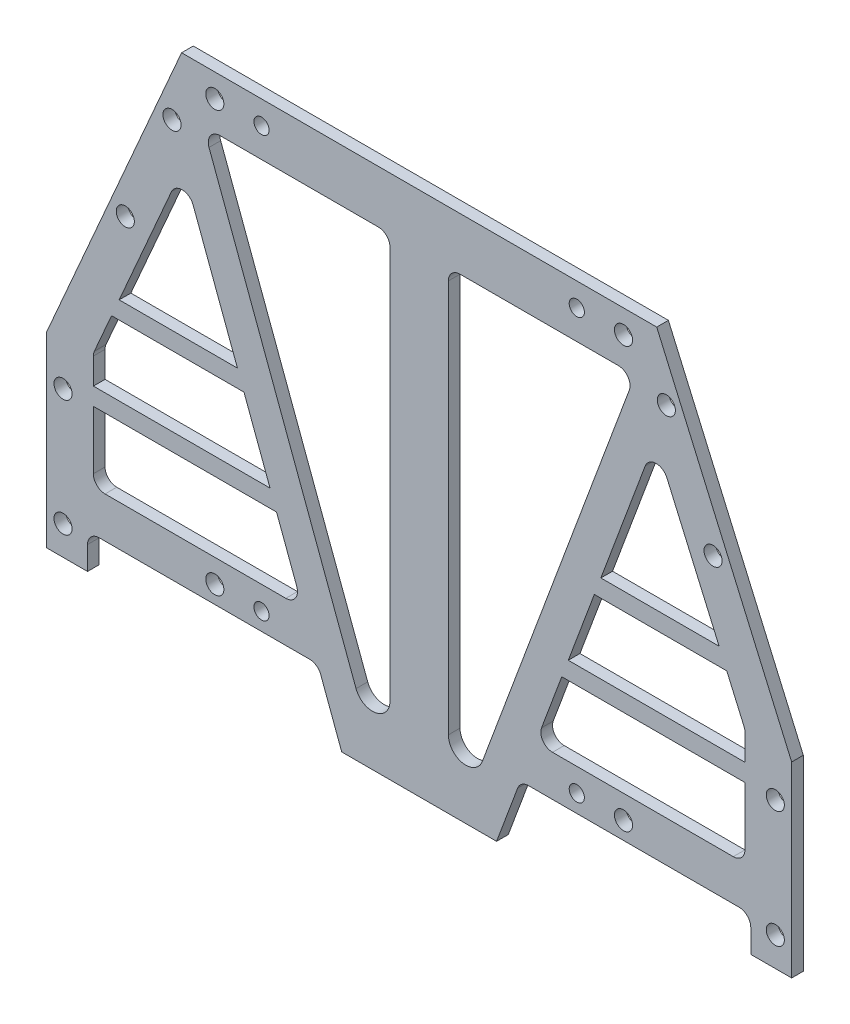
from build123d import *

# Parameters (mm, degrees)
SKETCH_1_R          = 40.9
SKETCH_1_R_2        = 1.525
EXTRUDE_1_DEPTH     = 2
EXTRUDE_2_DEPTH     = 2
SKETCH_4_R          = 1.55
CUT_EXTRUDE_2_DEPTH = 10
SKETCH_5_OUTSIDE_W  = 183.288
SKETCH_5_OUTSIDE_H  = 259.388
CUT_EXTRUDE_3_DEPTH = 10
SKETCH_7_R          = 1.3
SKETCH_7_R_2        = 1.55
CUT_EXTRUDE_4_DEPTH = 10
CUT_EXTRUDE_5_DEPTH = 10
SKETCH_9_W          = 25.793449444
SKETCH_9_H          = 3
SKETCH_9_W_2        = 31.374844792
EXTRUDE_4_DEPTH     = 2
SKETCH_12_W         = 20
SKETCH_12_H         = 5
CUT_EXTRUDE_7_DEPTH = 10


with BuildPart() as part:
    # 草图1 → 凸台-拉伸1 (new body)
    with BuildSketch(Plane.XY):
        with BuildLine():
            Line((-48, 105.1), (48, 105.1))
            Line((48, 105.1), (66, 105.1))
            Line((66, 105.1), (66, 52.6))
            Line((66, 52.6), (45.955327857, -13.860297311))
            ThreePointArc((45.955327857, -13.860297311), (0, -48), (-45.955327857, -13.860297311))
            Line((-45.955327857, -13.860297311), (-66, 52.6))
            Line((-66, 52.6), (-66, 105.1))
            Line((-66, 105.1), (-48, 105.1))
        make_face()
        Circle(SKETCH_1_R, mode=Mode.SUBTRACT)
        with Locations((12.835117837, 41.981778787)):
            Circle(SKETCH_1_R_2, mode=Mode.SUBTRACT)
        with Locations((-17.153096541, 40.410163067)):
            Circle(SKETCH_1_R_2, mode=Mode.SUBTRACT)
        with Locations((-31.749094475, 31.749094475)):
            Circle(SKETCH_1_R_2, mode=Mode.SUBTRACT)
        with Locations((31.749094475, 31.749094475)):
            Circle(SKETCH_1_R_2, mode=Mode.SUBTRACT)
        with Locations((31.749094475, -31.749094475)):
            Circle(SKETCH_1_R_2, mode=Mode.SUBTRACT)
        with Locations((-31.749094475, -31.749094475)):
            Circle(SKETCH_1_R_2, mode=Mode.SUBTRACT)
        with Locations((-9.5, 52.6)):
            Circle(SKETCH_1_R_2, mode=Mode.SUBTRACT)
        with Locations((9.5, 52.6)):
            Circle(SKETCH_1_R_2, mode=Mode.SUBTRACT)
    extrude(amount=EXTRUDE_1_DEPTH)

    # 草图3 → 凸台-拉伸2 (add)
    with BuildSketch(Plane.XY.offset(2)):
        Polygon((-66, 105.1), (-42, 160.1), (-22, 160.1), (22, 160.1), (42, 160.1), (66, 105.1), (22, 105.1), (-22, 105.1), align=None)
    extrude(amount=-EXTRUDE_2_DEPTH)

    # 草图4 → 切除-拉伸2 (cut)
    with BuildSketch(Plane.XY.offset(2)):
        with Locations((-61, 100.1)):
            Circle(SKETCH_4_R)
        with Locations((-61, 80.1)):
            Circle(SKETCH_4_R)
        with Locations((-42.333287047, 149.334828392)):
            Circle(SKETCH_4_R)
        with Locations((-50.332176167, 131.004040825)):
            Circle(SKETCH_4_R)
        with Locations((61, 80.1)):
            Circle(SKETCH_4_R)
        with Locations((61, 100.1)):
            Circle(SKETCH_4_R)
        with Locations((50.332176167, 131.004040825)):
            Circle(SKETCH_4_R)
        with Locations((42.333287047, 149.334828392)):
            Circle(SKETCH_4_R)
    extrude(amount=-CUT_EXTRUDE_2_DEPTH, mode=Mode.SUBTRACT)

    # 草图5 outside → 切除-拉伸3 (cut)
    with BuildSketch(Plane.XY.offset(2)):
        with Locations((0, 56.05)):
            Rectangle(SKETCH_5_OUTSIDE_W, SKETCH_5_OUTSIDE_H)
        Polygon((-40.690727285, 160.1), (-63.8, 107.141250029), (-63.8, 70.1), (63.8, 70.1), (63.8, 107.141250029), (40.690727285, 160.1), align=None, mode=Mode.SUBTRACT)
    extrude(amount=-CUT_EXTRUDE_3_DEPTH, mode=Mode.SUBTRACT)

    # 草图7 → 切除-拉伸4 (cut)
    with BuildSketch(Plane(origin=(0, 0, 0), x_dir=(-1, 0, 0), z_dir=(0, 0, -1))):
        with Locations((-27, 156.1)):
            Circle(SKETCH_7_R)
        with Locations((27, 156.1)):
            Circle(SKETCH_7_R)
        with Locations((-27, 84.1)):
            Circle(SKETCH_7_R)
        with Locations((27, 84.1)):
            Circle(SKETCH_7_R)
        with Locations((-35, 156.1)):
            Circle(SKETCH_7_R_2)
        with Locations((35, 156.1)):
            Circle(SKETCH_7_R_2)
        with Locations((-35, 84.1)):
            Circle(SKETCH_7_R_2)
        with Locations((35, 84.1)):
            Circle(SKETCH_7_R_2)
    extrude(amount=-CUT_EXTRUDE_4_DEPTH, mode=Mode.SUBTRACT)

    # 草图8 → 切除-拉伸5 (cut)
    with BuildSketch(Plane(origin=(0, 0, 0), x_dir=(-1, 0, 0), z_dir=(0, 0, -1))):
        with BuildLine():
            Line((-34.121847489, 151.1), (-7, 151.1))
            ThreePointArc((-7, 151.1), (-5.585786438, 150.514213562), (-5, 149.1))
            Line((-5, 149.1), (-5, 81.76505231))
            ThreePointArc((-5, 81.76505231), (-7.468491138, 78.812511315), (-10.811665553, 80.718851174))
            Line((-10.811665553, 80.718851174), (-35.996291191, 148.402532576))
            ThreePointArc((-35.996291191, 148.402532576), (-35.764244342, 150.241285493), (-34.121847489, 151.1))
        make_face()
        with BuildLine():
            Line((-38.719517417, 138.516098438), (-20.963747737, 90.797467424))
            ThreePointArc((-20.963747737, 90.797467424), (-21.195794586, 88.958714507), (-22.83819144, 88.1))
            Line((-22.83819144, 88.1), (-53.8, 88.1))
            ThreePointArc((-53.8, 88.1), (-55.214213562, 88.685786438), (-55.8, 90.1))
            Line((-55.8, 90.1), (-55.8, 107.554791913))
            ThreePointArc((-55.8, 107.554791913), (-55.757825007, 107.963351875), (-55.633078757, 108.354680825))
            Line((-55.633078757, 108.354680825), (-42.427039876, 138.618519926))
            ThreePointArc((-42.427039876, 138.618519926), (-40.538731553, 139.817868293), (-38.719517417, 138.516098438))
        make_face()
        with BuildLine():
            Line((-56.8, 79.1), (-56.8, 67.1))
            ThreePointArc((-56.8, 67.1), (-56.214213562, 65.685786438), (-54.8, 65.1))
            Line((-54.8, 65.1), (-14.280051905, 65.1))
            ThreePointArc((-14.280051905, 65.1), (-12.637655051, 65.958714507), (-12.405608203, 67.797467424))
            Line((-12.405608203, 67.797467424), (-16.870724482, 79.797467424))
            ThreePointArc((-16.870724482, 79.797467424), (-17.603882691, 80.742396853), (-18.745168184, 81.1))
            Line((-18.745168184, 81.1), (-54.8, 81.1))
            ThreePointArc((-54.8, 81.1), (-56.214213562, 80.514213562), (-56.8, 79.1))
        make_face()
        with BuildLine():
            Line((18.745168184, 81.1), (54.8, 81.1))
            ThreePointArc((54.8, 81.1), (56.214213562, 80.514213562), (56.8, 79.1))
            Line((56.8, 79.1), (56.8, 67.1))
            ThreePointArc((56.8, 67.1), (56.214213562, 65.685786438), (54.8, 65.1))
            Line((54.8, 65.1), (14.280051905, 65.1))
            ThreePointArc((14.280051905, 65.1), (12.637655051, 65.958714507), (12.405608203, 67.797467424))
            Line((12.405608203, 67.797467424), (16.870724482, 79.797467424))
            ThreePointArc((16.870724482, 79.797467424), (17.603882691, 80.742396853), (18.745168184, 81.1))
        make_face()
        with BuildLine():
            Line((55.633078757, 108.354680825), (42.427039876, 138.618519926))
            ThreePointArc((42.427039876, 138.618519926), (40.538731553, 139.817868293), (38.719517417, 138.516098438))
            Line((38.719517417, 138.516098438), (20.963747737, 90.797467424))
            ThreePointArc((20.963747737, 90.797467424), (21.195794586, 88.958714507), (22.83819144, 88.1))
            Line((22.83819144, 88.1), (53.8, 88.1))
            ThreePointArc((53.8, 88.1), (55.214213562, 88.685786438), (55.8, 90.1))
            Line((55.8, 90.1), (55.8, 107.554791913))
            ThreePointArc((55.8, 107.554791913), (55.757825007, 107.963351875), (55.633078757, 108.354680825))
        make_face()
        with BuildLine():
            Line((10.811665553, 80.718851174), (35.996291191, 148.402532576))
            ThreePointArc((35.996291191, 148.402532576), (35.764244342, 150.241285493), (34.121847489, 151.1))
            Line((34.121847489, 151.1), (7, 151.1))
            ThreePointArc((7, 151.1), (5.585786438, 150.514213562), (5, 149.1))
            Line((5, 149.1), (5, 81.76505231))
            ThreePointArc((5, 81.76505231), (7.468491138, 78.812511315), (10.811665553, 80.718851174))
        make_face()
    extrude(amount=-CUT_EXTRUDE_5_DEPTH, mode=Mode.SUBTRACT)

    # 草图9 → 凸台-拉伸4 (add)
    with BuildSketch(Plane(origin=(0, 0, 0), x_dir=(-1, 0, 0), z_dir=(0, 0, -1))):
        with Locations((-42.903275278, 116.6)):
            Rectangle(SKETCH_9_W, SKETCH_9_H)
        with Locations((-40.112577604, 101.6)):
            Rectangle(SKETCH_9_W_2, SKETCH_9_H)
        with Locations((40.112577604, 101.6)):
            Rectangle(SKETCH_9_W_2, SKETCH_9_H)
        with Locations((42.903275278, 116.6)):
            Rectangle(SKETCH_9_W, SKETCH_9_H)
    extrude(amount=-EXTRUDE_4_DEPTH)

    # 草图12 → 切除-拉伸7 (cut)
    with BuildSketch(Plane(origin=(0, 0, 0), x_dir=(-1, 0, 0), z_dir=(0, 0, -1))):
        with Locations((-53.8, 72.6)):
            Rectangle(SKETCH_12_W, SKETCH_12_H)
        with Locations((53.8, 72.6)):
            Rectangle(SKETCH_12_W, SKETCH_12_H)
    extrude(amount=-CUT_EXTRUDE_7_DEPTH, mode=Mode.SUBTRACT)


solid = part.part
